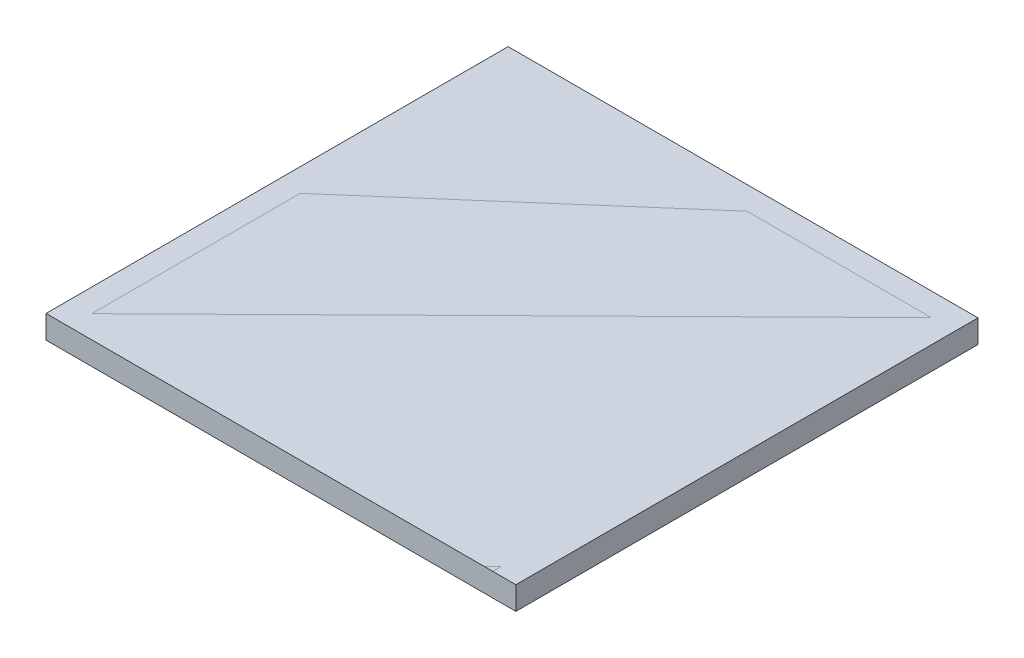
from build123d import *

# Parameters (mm, degrees)
SKETCH1_W           = 61
SKETCH1_H           = 60
BOSS_EXTRUDE1_DEPTH = 3
BOSS_EXTRUDE2_DEPTH = 3
SKETCH3_W           = 8
SKETCH3_H           = 3
CUT_EXTRUDE1_DEPTH  = 3


with BuildPart() as part:
    # Sketch1 → Boss-Extrude1 (new body)
    with BuildSketch(Plane(origin=(0, 0, 0), x_dir=(1, 0, 0), z_dir=(0, 1, 0))):
        Rectangle(SKETCH1_W, SKETCH1_H)
    extrude(amount=BOSS_EXTRUDE1_DEPTH)


with BuildPart() as body_2:
    # Sketch2 → Boss-Extrude2 (new body)
    with BuildSketch(Plane.XZ):
        Polygon((-30.5, -30), (30.5, -30), (30.5, -20), (27.5, -20), (27.5, -10), (30.5, -10), (30.5, 0), (27.5, 0), (27.5, 10), (30.5, 10), (30.5, 20), (27.5, 20), (27.5, 30), (-27.5, 30), (-27.5, 20), (-30.5, 20), (-30.5, 10), (-27.5, 10), (-27.5, 0), (-30.5, 0), (-30.5, -10), (-27.5, -10), (-27.5, -20), (-30.5, -20), align=None)
    extrude(amount=-BOSS_EXTRUDE2_DEPTH)

    # Sketch3 → Cut-Extrude1 (cut)
    with BuildSketch(Plane.XZ):
        Polygon((27.5, -27), (19.5, -27), (19.5, -30), (30.5, -30), (30.5, -27), align=None)
        with Locations((7.5, -28.5)):
            Rectangle(SKETCH3_W, SKETCH3_H)
        with Locations((-7.5, -28.5)):
            Rectangle(SKETCH3_W, SKETCH3_H)
        Polygon((-19.5, -27), (-27.5, -27), (-30.5, -27), (-30.5, -30), (-19.5, -30), align=None)
    extrude(amount=-CUT_EXTRUDE1_DEPTH, mode=Mode.SUBTRACT)


solid = Compound([part.part, body_2.part])
